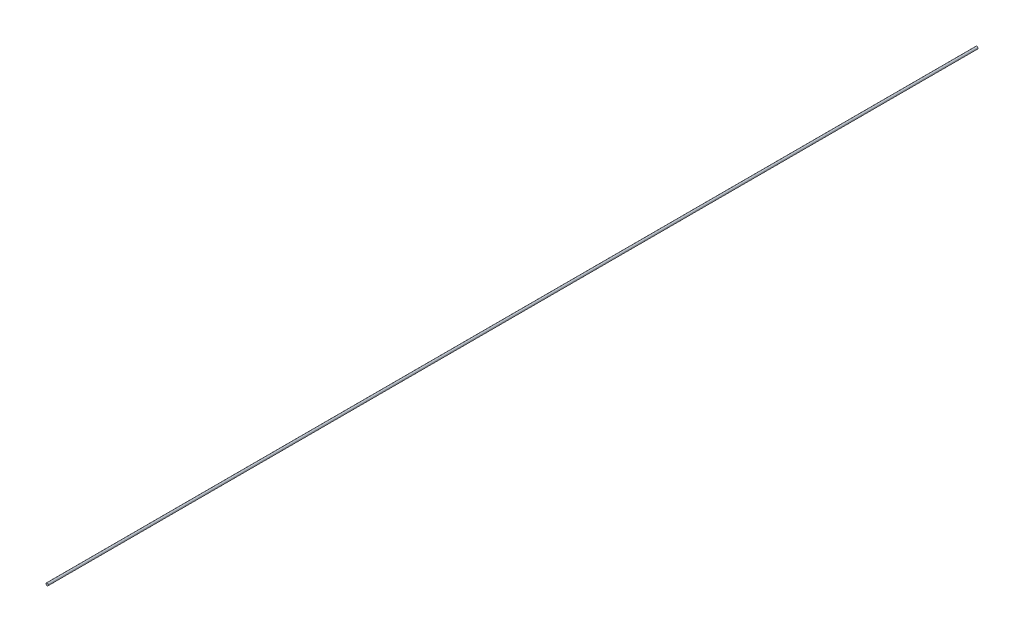
from build123d import *

# Parameters (mm, degrees)
ESQUISSE1_R        = 1
BOSS_EXTRU_1_DEPTH = 800


with BuildPart() as part:
    # Esquisse1 → Boss.-Extru.1 (new body)
    with BuildSketch(Plane.XY):
        Circle(ESQUISSE1_R)
    extrude(amount=BOSS_EXTRU_1_DEPTH)


solid = part.part
